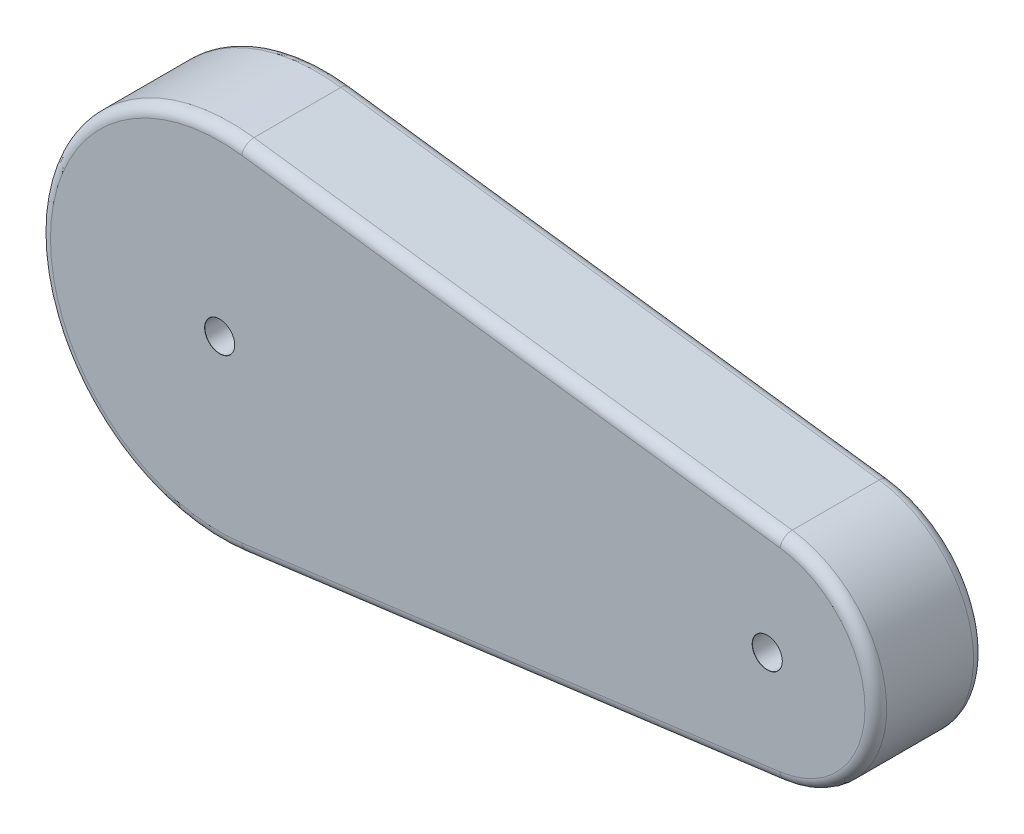
from build123d import *

# Parameters (mm, degrees)
BRAS_DEPTH              = 10
PER_AGE_M51_D           = 5.5
PER_AGE_M51_CSINK_D     = 5.55
PER_AGE_M51_CSINK_ANGLE = 90
CONG_1_R                = 2


with BuildPart() as part:
    # Profil Bras → Bras (new, symmetric)
    with BuildSketch(Plane.XY):
        with BuildLine():
            Line((-46.102514264, 32.881516449), (53.041971873, 19.828897227))
            ThreePointArc((53.041971873, 19.828897227), (70.431448029, 0), (53.041971873, -19.828897227))
            Line((53.041971873, -19.828897227), (-46.102514264, -32.881516449))
            ThreePointArc((-46.102514264, -32.881516449), (-83.596697788, 0), (-46.102514264, 32.881516449))
        make_face()
    extrude(amount=BRAS_DEPTH, both=True)

    # Perçage M51 (through all)
    with Locations(Plane.XY.offset(10)):
        with Locations((-50.431448029, 0), (50.431448029, 0)):
            CounterSinkHole(PER_AGE_M51_D / 2, PER_AGE_M51_CSINK_D / 2, counter_sink_angle=PER_AGE_M51_CSINK_ANGLE)

    # Congé1
    cong_1_edges = [part.edges().sort_by_distance(p)[0] for p in [
        (70.431448029, 0, 10),
        (3.469728805, 26.355206838, 10),
        (-83.596697788, 0, 10),
        (3.469728805, 26.355206838, -10),
        (70.431448029, 0, -10),
        (3.469728805, -26.355206838, -10),
        (-83.596697788, 0, -10),
        (3.469728805, -26.355206838, 10),
    ]]
    fillet(cong_1_edges, radius=CONG_1_R)


solid = part.part
